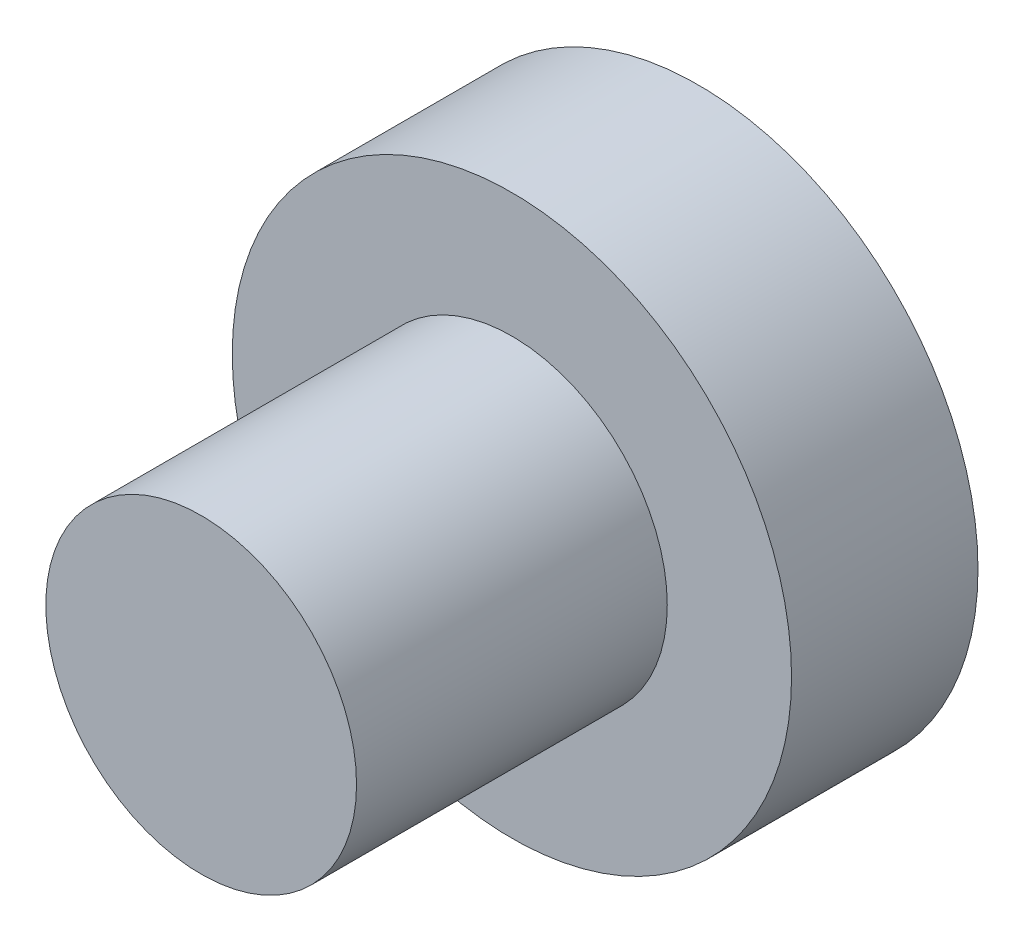
from build123d import *

# Parameters (mm, degrees)
SKETCH2_R           = 4.5
SKETCH2_R_2         = 2.5
BOSS_EXTRUDE1_DEPTH = 3
SKETCH3_R           = 2.5
BOSS_EXTRUDE2_DEPTH = 5


with BuildPart() as part:
    # Sketch2 → Boss-Extrude1 (new body)
    with BuildSketch(Plane.XY):
        Circle(SKETCH2_R)
        Circle(SKETCH2_R_2, mode=Mode.SUBTRACT)
    extrude(amount=BOSS_EXTRUDE1_DEPTH)


with BuildPart() as body_2:
    # Sketch3 → Boss-Extrude2 (new body)
    with BuildSketch(Plane.XY.offset(3)):
        Circle(SKETCH3_R)
    extrude(amount=BOSS_EXTRUDE2_DEPTH)


solid = Compound([part.part, body_2.part])
